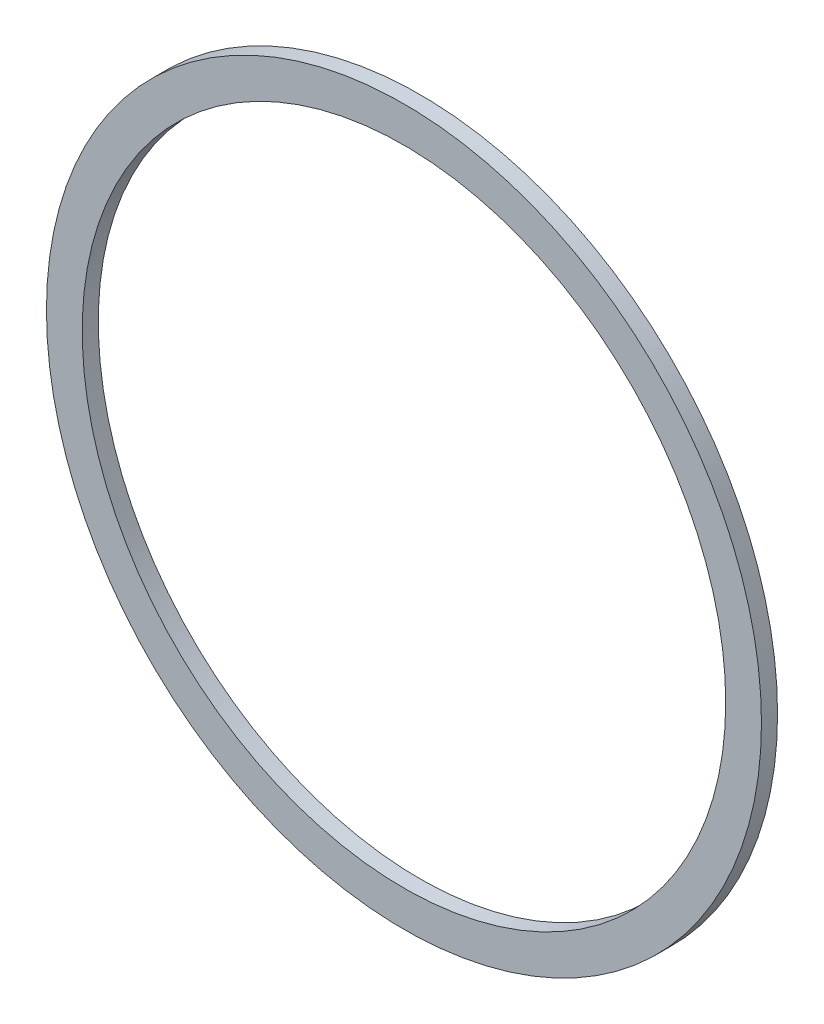
from build123d import *

# Parameters (mm, degrees)
SKETCH_1_R      = 40
SKETCH_1_R_2    = 36
EXTRUDE_1_DEPTH = 1.8


with BuildPart() as part:
    # 草图1 → 凸台-拉伸1 (new body)
    with BuildSketch(Plane.XY):
        Circle(SKETCH_1_R)
        Circle(SKETCH_1_R_2, mode=Mode.SUBTRACT)
    extrude(amount=EXTRUDE_1_DEPTH)


solid = part.part
